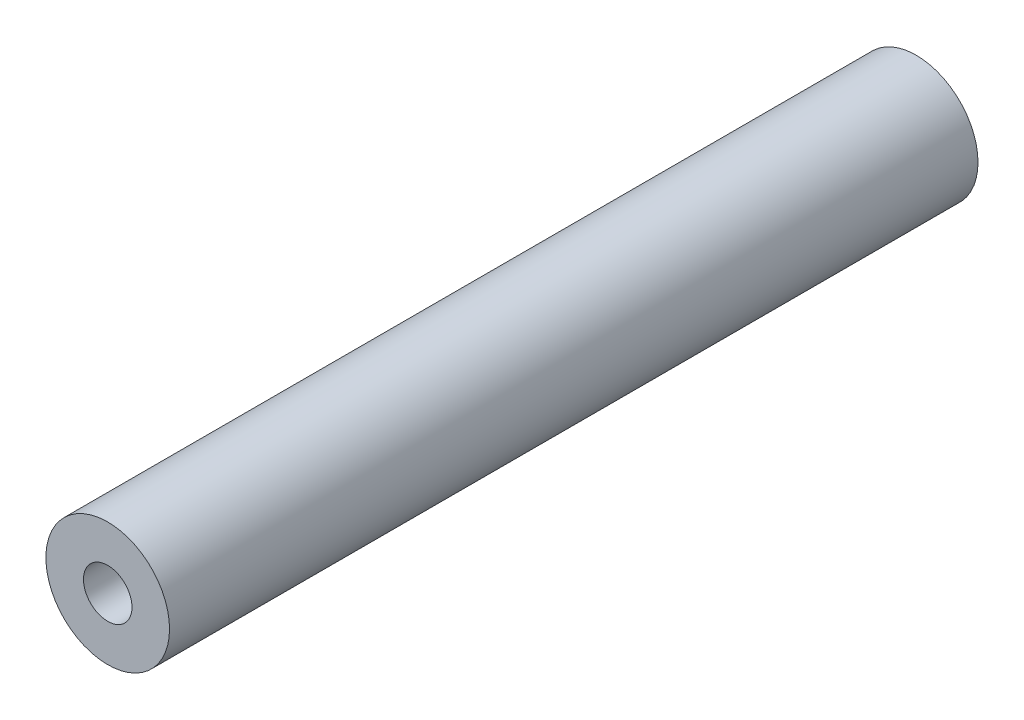
from build123d import *

# Parameters (mm, degrees)
SKETCH1_R           = 6.5
SKETCH1_R_2         = 2.55
BOSS_EXTRUDE1_DEPTH = 85


with BuildPart() as part:
    # Sketch1 → Boss-Extrude1 (new body)
    with BuildSketch(Plane.XY):
        Circle(SKETCH1_R)
        Circle(SKETCH1_R_2, mode=Mode.SUBTRACT)
    extrude(amount=BOSS_EXTRUDE1_DEPTH)


solid = part.part
